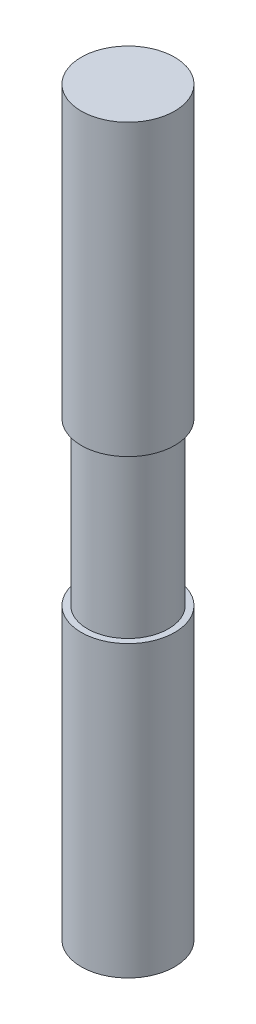
from build123d import *

# Parameters (mm, degrees)
SKETCH2_R               = 4.7625
BOSS_EXTRUDE1_DEPTH     = 75.565
CUT_EXTRUDE1_DEPTH      = 8.255
CUT_EXTRUDE1_DEPTH_BACK = 8.255
SKETCH3_OUTSIDE_W       = 26.878
SKETCH3_OUTSIDE_H       = 26.878
SKETCH3_OUTSIDE_R       = 4.1275


with BuildPart() as part:
    # Sketch2 → Boss-Extrude1 (new body)
    with BuildSketch(Plane(origin=(0, 0, 0), x_dir=(1, 0, 0), z_dir=(0, 1, 0))):
        with Locations(Location((0, 0, 0), (0, 0, 270))):
            Circle(SKETCH2_R)
    extrude(amount=BOSS_EXTRUDE1_DEPTH)

    # Sketch3 outside → Cut-Extrude1 (cut, two sides: drawn at the far end of the back side and taken through both)
    with BuildSketch(Plane(origin=(0, 37.7825, 0), x_dir=(1, 0, 0), z_dir=(0, 1, 0)).offset(-CUT_EXTRUDE1_DEPTH_BACK)):
        Rectangle(SKETCH3_OUTSIDE_W, SKETCH3_OUTSIDE_H)
        with Locations(Location((0, 0, 0), (0, 0, 270))):
            Circle(SKETCH3_OUTSIDE_R, mode=Mode.SUBTRACT)
    extrude(amount=CUT_EXTRUDE1_DEPTH + CUT_EXTRUDE1_DEPTH_BACK, mode=Mode.SUBTRACT)


solid = part.part
